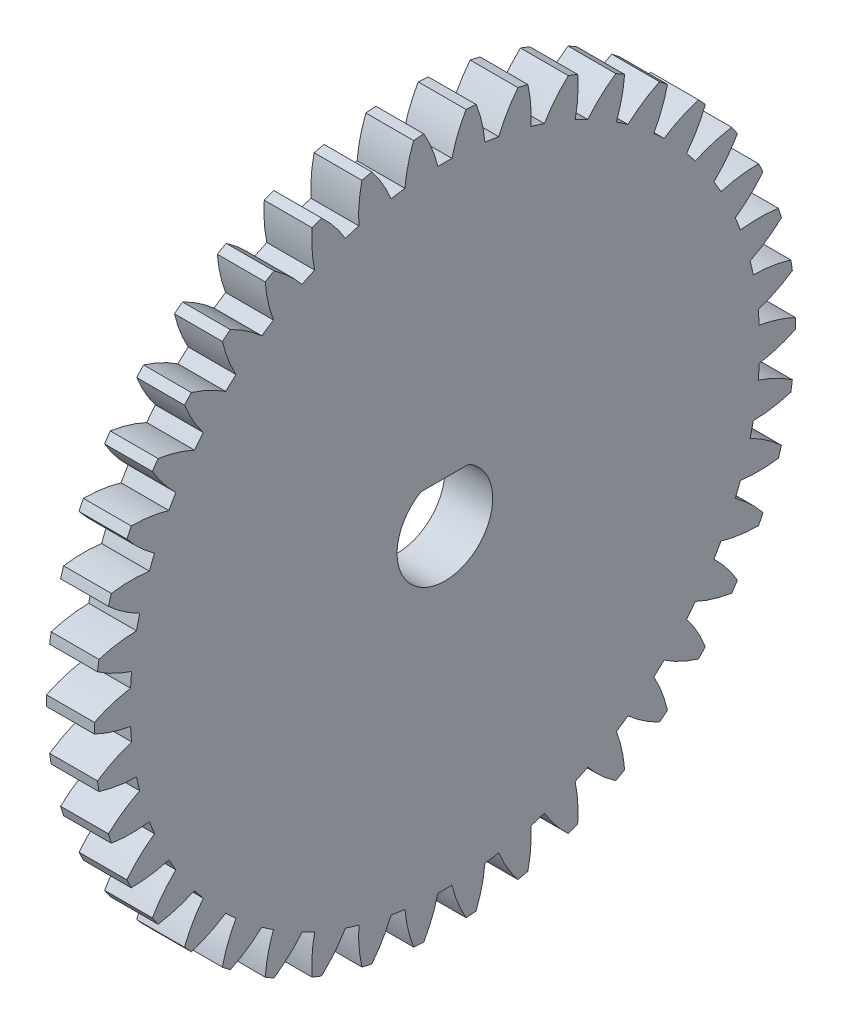
from build123d import *

# Parameters (mm, degrees)
BASPROSKE_W         = 6
BASPROSKE_H         = 44
TOOTHCUT_DEPTH      = 63.513998432
TEETHCUTS_COUNT     = 42
TEETHCUTS_ANGLE     = 351.428571429
BORSKE_R            = 6
BORE_DEPTH          = 50.0000508
BOSS_EXTRUDE1_DEPTH = 6


with BuildPart() as part:
    # BasProSke → Base-Revolve (revolve)
    with BuildSketch(Plane(origin=(0, 0, 0), x_dir=(1, 0, 0), z_dir=(0, 1, 0)), mode=Mode.PRIVATE) as base_revolve_sk:
        with Locations((3, 22)):
            Rectangle(BASPROSKE_W, BASPROSKE_H)
    revolve(base_revolve_sk.sketch.rotate(Axis((-10, 0, 0), (1, 0, 0)), 180), axis=Axis((-10, 0, 0), (1, 0, 0)))

    # TooCutSke → ToothCut (cut, through all)
    with BuildSketch(Plane(origin=(0, 0, 0), x_dir=(0, 0, -1), z_dir=(1, 0, 0))):
        with BuildLine():
            ThreePointArc((0.877582471, 39.489249803), (0, 39.499), (-0.877582471, 39.489249803))
            ThreePointArc((-0.877582471, 39.489249803), (-1.612128187, 41.781146885), (-2.666625076, 43.944566853))
            ThreePointArc((-2.666625076, 43.944566853), (0, 44.0254), (2.666625076, 43.944566853))
            ThreePointArc((2.666625076, 43.944566853), (1.612128187, 41.781146885), (0.877582471, 39.489249803))
        make_face()
    toothcut = extrude(amount=TOOTHCUT_DEPTH, mode=Mode.SUBTRACT)

    # TeethCuts: ToothCut ×42 about axis
    teethcuts_axis = Axis((-10, 0, 0), (1, 0, 0))
    for i in range(1, TEETHCUTS_COUNT):
        add(toothcut.rotate(teethcuts_axis, i * TEETHCUTS_ANGLE / (TEETHCUTS_COUNT - 1)), mode=Mode.SUBTRACT)

    # BorSke → Bore (cut, symmetric)
    with BuildSketch(Plane(origin=(0, 0, 0), x_dir=(0, 0, -1), z_dir=(1, 0, 0))):
        with Locations(Location((0, 0, 0), (0, 0, 180))):
            Circle(BORSKE_R)
    extrude(amount=BORE_DEPTH, both=True, mode=Mode.SUBTRACT)

    # Sketch1 → Boss-Extrude1 (add)
    with BuildSketch(Plane(origin=(6, 0, 0), x_dir=(0, 0, -1), z_dir=(1, 0, 0))):
        with BuildLine():
            Line((-3, 5.196152423), (3, 5.196152423))
            ThreePointArc((3, 5.196152423), (0, 6), (-3, 5.196152423))
        make_face()
    extrude(amount=-BOSS_EXTRUDE1_DEPTH)


solid = part.part
